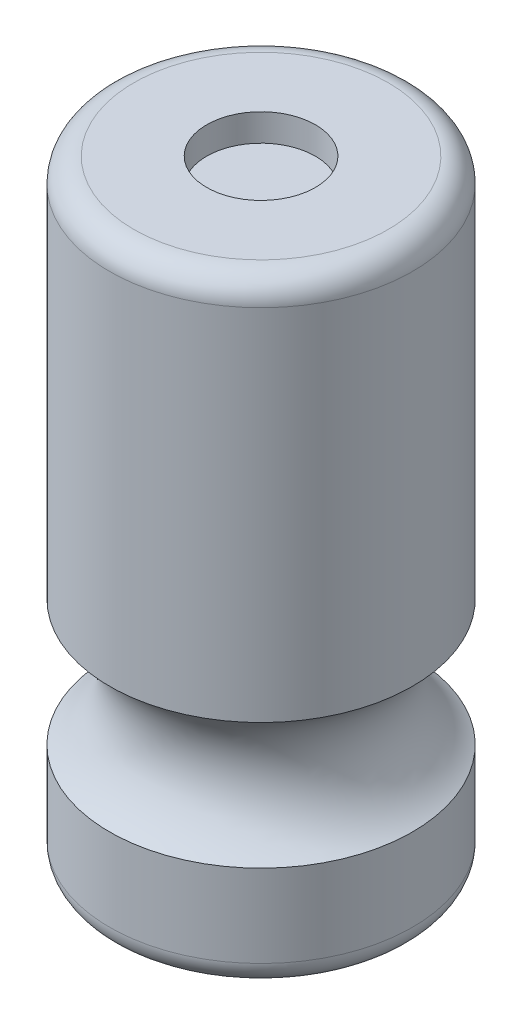
from build123d import *


with BuildPart() as part:
    # Sketch1 → Revolve1 (revolve)
    with BuildSketch(Plane.XY, mode=Mode.PRIVATE) as revolve1_sk:
        with BuildLine():
            Line((1.119951293, 12.2), (0, 12.2))
            Line((0, 12.2), (0, 1))
            Line((0, 1), (1.119951293, 1))
            Line((1.119951293, 1), (1.119951293, 0.061488909))
            Line((1.119951293, 0.061488909), (2.619951293, 0.061488909))
            ThreePointArc((2.619951293, 0.061488909), (2.973504683, 0.207935519), (3.119951293, 0.561488909))
            Line((3.119951293, 0.561488909), (3.119951293, 2.262450804))
            ThreePointArc((3.119951293, 2.262450804), (2.369951293, 3.561488909), (3.119951293, 4.860527015))
            Line((3.119951293, 4.860527015), (3.119951293, 12.261488905))
            ThreePointArc((3.119951293, 12.261488905), (2.973504683, 12.615042295), (2.619951293, 12.761488905))
            Line((2.619951293, 12.761488905), (1.119951293, 12.761488905))
            Line((1.119951293, 12.761488905), (1.119951293, 12.2))
        make_face()
    revolve(revolve1_sk.sketch.rotate(Axis((0, 20.003281327, 0), (0, -1, 0)), 270), axis=Axis((0, 20.003281327, 0), (0, -1, 0)))


solid = part.part
